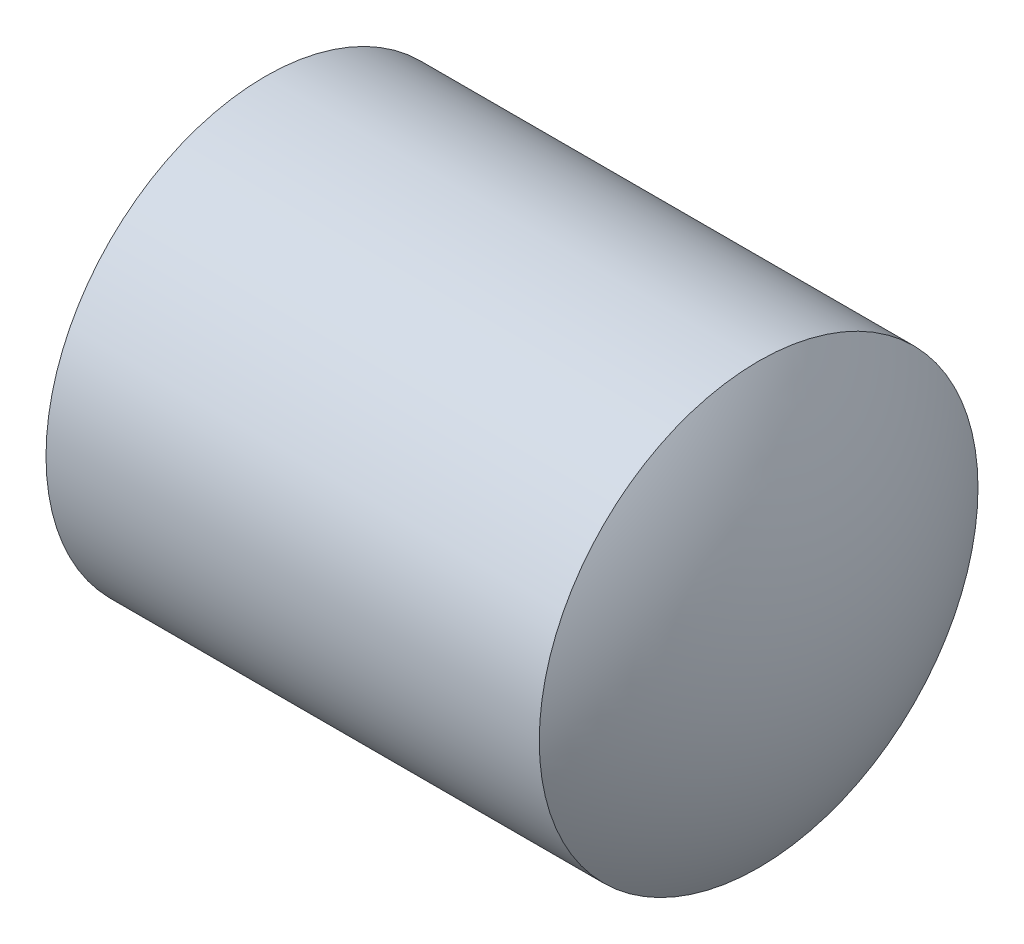
from build123d import *

# Parameters (mm, degrees)
HEX_2_DEPTH = 1.5


with BuildPart() as part:
    # BodySke → BaseBody (revolve)
    with BuildSketch(Plane.XY, mode=Mode.PRIVATE) as basebody_sk:
        with BuildLine():
            Line((0, 0), (0, 1.2195))
            Line((0, 1.2195), (0.161946751, 1.5))
            Line((0.161946751, 1.5), (3.534605227, 1.5))
            ThreePointArc((3.534605227, 1.5), (3.880978452, 0.785269427), (4, 0))
            Line((4, 0), (0, 0))
        make_face()
    revolve(basebody_sk.sketch.rotate(Axis((-12.7, 0, 0), (1, 0, 0)), 90), axis=Axis((-12.7, 0, 0), (1, 0, 0)))

    # Sketch2 → Hex 2 (cut)
    with BuildSketch(Plane.ZY):
        Polygon((0.433012702, 0.75), (-0.433012702, 0.75), (-0.866025404, 0), (-0.433012702, -0.75), (0.433012702, -0.75), (0.866025404, 0), align=None)
    extrude(amount=-HEX_2_DEPTH, mode=Mode.SUBTRACT)


solid = part.part
